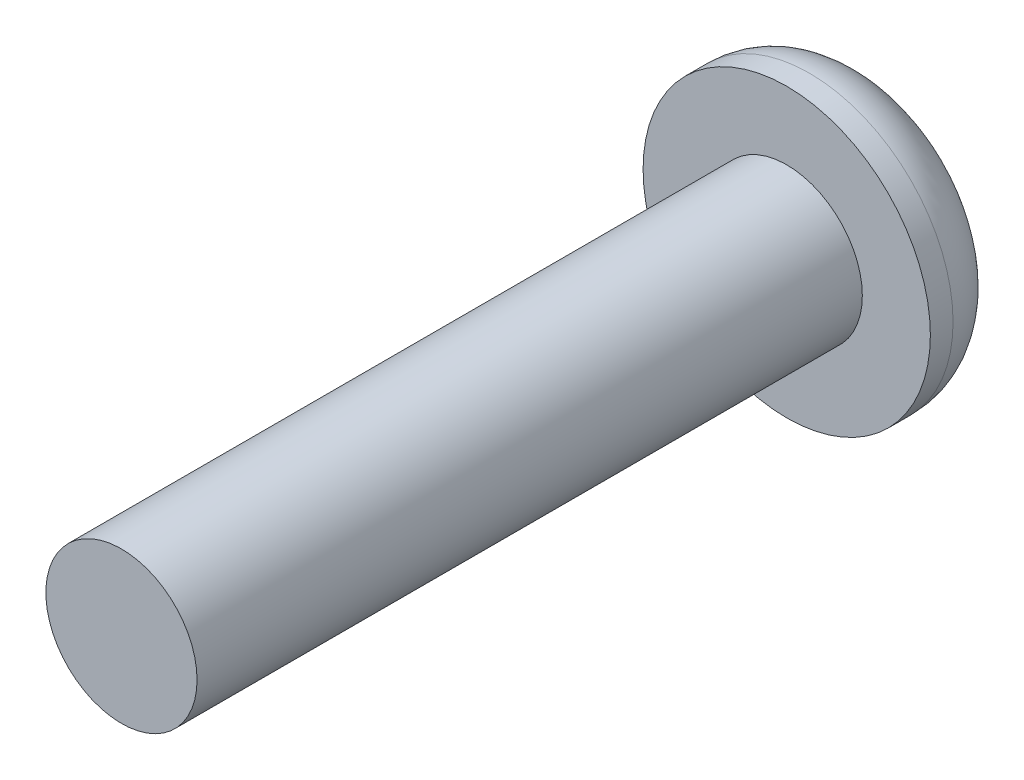
from build123d import *

# Parameters (mm, degrees)
SKETCH_1_R      = 2.5
EXTRUDE_1_DEPTH = 22
SKETCH_2_R      = 4.75
EXTRUDE_2_DEPTH = 2.75
FILLET_1_R      = 2


with BuildPart() as part:
    # 草图1 → 凸台-拉伸1 (new body)
    with BuildSketch(Plane.XY):
        Circle(SKETCH_1_R)
    extrude(amount=EXTRUDE_1_DEPTH)

    # 草图2 → 凸台-拉伸2 (add)
    with BuildSketch(Plane(origin=(0, 0, 0), x_dir=(-1, 0, 0), z_dir=(0, 0, -1))):
        Circle(SKETCH_2_R)
    extrude(amount=EXTRUDE_2_DEPTH)

    # 圆角1
    fillet_1_edges = [part.edges().sort_by_distance(p)[0] for p in [
        (4.75, 0, -2.75),
    ]]
    fillet(fillet_1_edges, radius=FILLET_1_R)


solid = part.part
